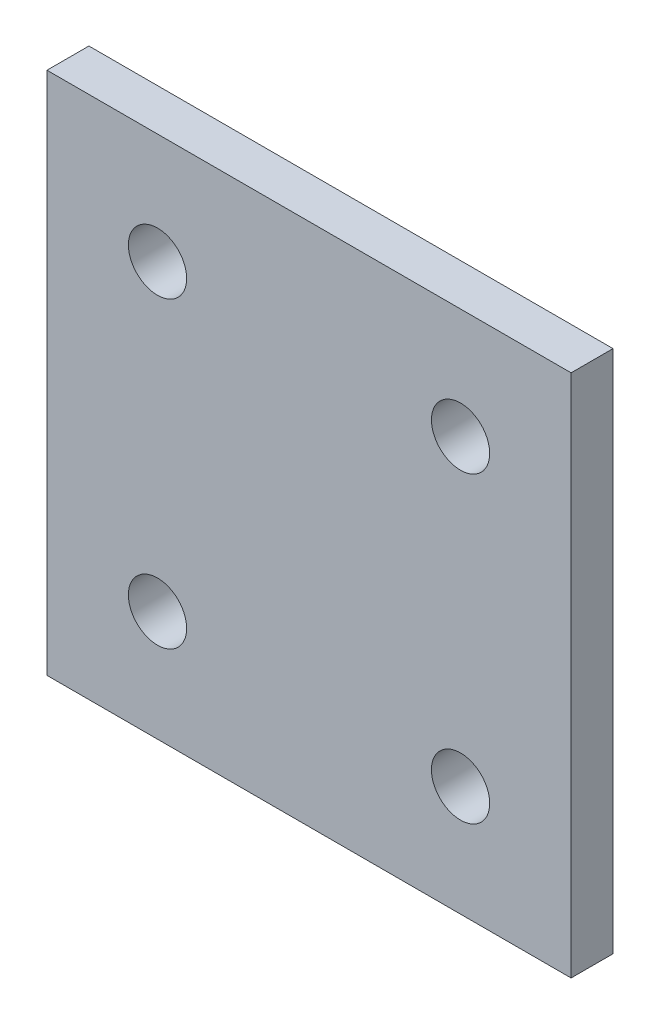
from build123d import *

# Parameters (mm, degrees)
SKETCH1_W           = 57.15
SKETCH1_H           = 57.15
SKETCH1_R           = 3.175
SKETCH1_R_2         = 11.3
BOSS_EXTRUDE1_DEPTH = 2.032
BOSS_EXTRUDE2_START = 2.032
SKETCH1_2_W         = 57.15
SKETCH1_2_H         = 57.15
SKETCH1_2_R         = 11.3
SKETCH1_2_R_2       = 3.175
BOSS_EXTRUDE2_DEPTH = 2.54


with BuildPart() as part:
    # Sketch1 → Boss-Extrude1 (new body)
    with BuildSketch(Plane.XY):
        Rectangle(SKETCH1_W, SKETCH1_H)
        with Locations((-16.522101848, 16.522101848)):
            Circle(SKETCH1_R, mode=Mode.SUBTRACT)
        with Locations((16.522101848, 16.522101848)):
            Circle(SKETCH1_R, mode=Mode.SUBTRACT)
        with Locations((16.522101848, -16.522101848)):
            Circle(SKETCH1_R, mode=Mode.SUBTRACT)
        with Locations((-16.522101848, -16.522101848)):
            Circle(SKETCH1_R, mode=Mode.SUBTRACT)
        Circle(SKETCH1_R_2, mode=Mode.SUBTRACT)
    extrude(amount=BOSS_EXTRUDE1_DEPTH)

    # Sketch1<2> → Boss-Extrude2 (add)
    # profile 1 of 2: a face of its own
    with BuildSketch(Plane.XY.offset(BOSS_EXTRUDE2_START)):
        Rectangle(SKETCH1_2_W, SKETCH1_2_H)
        Circle(SKETCH1_2_R, mode=Mode.SUBTRACT)
        with Locations(Location((-16.522101848, -16.522101848, 0), (0, 0, 180))):
            Circle(SKETCH1_2_R_2, mode=Mode.SUBTRACT)
        with Locations(Location((16.522101848, -16.522101848, 0), (0, 0, 180))):
            Circle(SKETCH1_2_R_2, mode=Mode.SUBTRACT)
        with Locations(Location((16.522101848, 16.522101848, 0), (0, 0, 180))):
            Circle(SKETCH1_2_R_2, mode=Mode.SUBTRACT)
        with Locations(Location((-16.522101848, 16.522101848, 0), (0, 0, 180))):
            Circle(SKETCH1_2_R_2, mode=Mode.SUBTRACT)
    # profile 2 of 2: a face of its own
    with BuildSketch(Plane.XY.offset(BOSS_EXTRUDE2_START)):
        Circle(SKETCH1_2_R)
    extrude(amount=BOSS_EXTRUDE2_DEPTH)


solid = part.part
